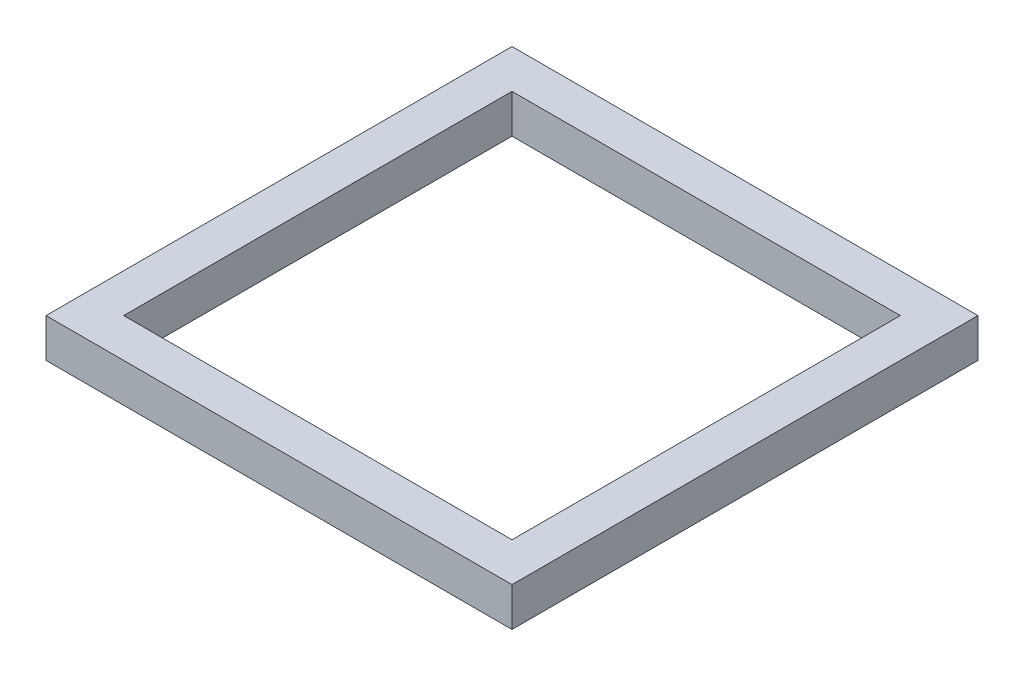
from build123d import *

# Parameters (mm, degrees)
SKETCH3_W           = 60
SKETCH3_H           = 60
SKETCH3_W_2         = 50
SKETCH3_H_2         = 50
BOSS_EXTRUDE1_DEPTH = 5


with BuildPart() as part:
    # Sketch3 → Boss-Extrude1 (new body)
    with BuildSketch(Plane(origin=(0, 0, 0), x_dir=(1, 0, 0), z_dir=(0, 1, 0))):
        Rectangle(SKETCH3_W, SKETCH3_H)
        Rectangle(SKETCH3_W_2, SKETCH3_H_2, mode=Mode.SUBTRACT)
    extrude(amount=BOSS_EXTRUDE1_DEPTH)


solid = part.part
